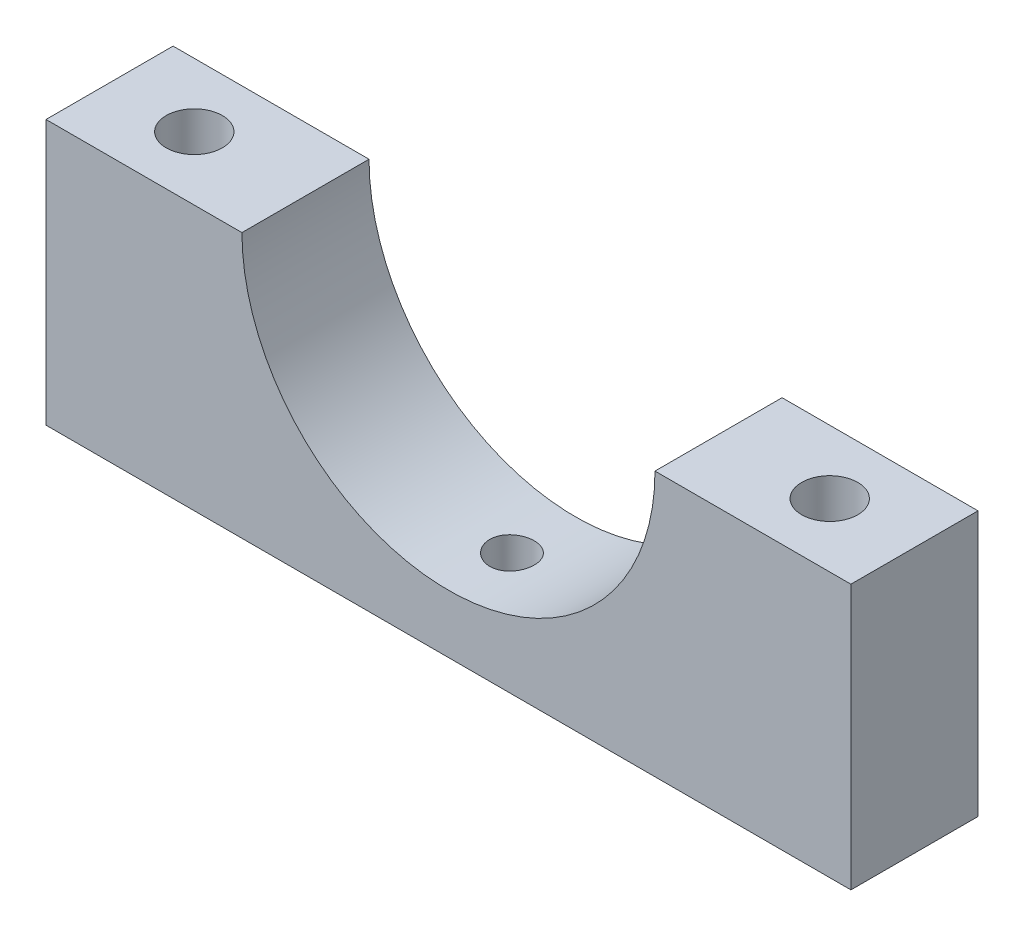
from build123d import *

# Parameters (mm, degrees)
SKETCH_1_W                = 76
SKETCH_1_H                = 12
EXTRUDE_1_DEPTH           = 25
CUT_EXTRUDE_1_REACH       = 49.043
SKETCH_2_R                = 19.5
HOLE_WIZARD_M5_1_D        = 4.2
HOLE_WIZARD_1_D           = 5.3
HOLE_WIZARD_1_CBORE_D     = 10
HOLE_WIZARD_1_CBORE_DEPTH = 8.7


with BuildPart() as part:
    # 草图1 → 凸台-拉伸1 (new body)
    with BuildSketch(Plane(origin=(0, 0, 0), x_dir=(1, 0, 0), z_dir=(0, 1, 0))):
        Rectangle(SKETCH_1_W, SKETCH_1_H)
    extrude(amount=-EXTRUDE_1_DEPTH)

    # 草图2 → 切除-拉伸1 (cut, up to next)
    with BuildSketch(Plane.XY.offset(6), mode=Mode.PRIVATE) as cut_extrude_1_sk1:
        Circle(SKETCH_2_R)
    cut_extrude_1_tool1 = extrude(cut_extrude_1_sk1.sketch, amount=-CUT_EXTRUDE_1_REACH, mode=Mode.PRIVATE) & part.part
    add(cut_extrude_1_tool1.solids().sort_by_distance((0, 0, 6))[0], mode=Mode.SUBTRACT)

    # M5 螺纹孔1 (through all)
    with Locations(Plane.XZ.offset(25)):
        with Locations((0, 0)):
            Hole(HOLE_WIZARD_M5_1_D / 2)

    # 打孔尺寸根据内六角圆柱头螺钉的类型1 (through all)
    with Locations(Plane.XZ.offset(25)):
        with Locations((-30, 0), (30, 0)):
            CounterBoreHole(HOLE_WIZARD_1_D / 2, HOLE_WIZARD_1_CBORE_D / 2, HOLE_WIZARD_1_CBORE_DEPTH)


solid = part.part
